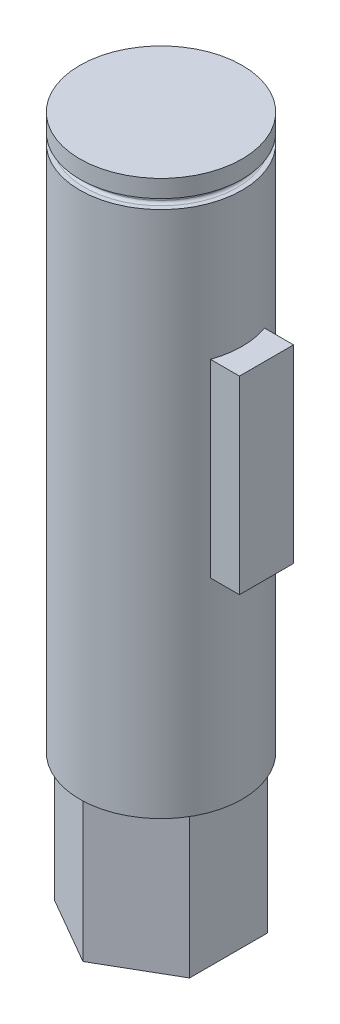
from build123d import *

# Parameters (mm, degrees)
BOSS_EXTRUDE1_DEPTH   = 14
SKETCH2_R             = 6
BOSS_EXTRUDE2_DEPTH   = 12
BOSS_EXTRUDE3_START   = 15
SKETCH3_R             = 6
BOSS_EXTRUDE3_DEPTH   = 15
BOSS_EXTRUDE4_DEPTH   = 10.5
M4_TAPPED_HOLE1_D     = 3.3
M4_TAPPED_HOLE1_DEPTH = 10.1
M4_TAPPED_HOLE1_TIP   = 0.991420021


with BuildPart() as part:
    # Sketch1 → Boss-Extrude1 (new body)
    with BuildSketch(Plane(origin=(0, 0, 0), x_dir=(1, 0, 0), z_dir=(0, 1, 0))):
        with BuildLine():
            Line((7.8, -2), (7.8, 2))
            Line((7.8, 2), (5.656854249, 2))
            ThreePointArc((5.656854249, 2), (-6, 0), (5.656854249, -2))
            Line((5.656854249, -2), (7.8, -2))
        make_face()
    extrude(amount=BOSS_EXTRUDE1_DEPTH)

    # Sketch2 → Boss-Extrude2 (add)
    with BuildSketch(Plane(origin=(0, 14, 0), x_dir=(1, 0, 0), z_dir=(0, 1, 0))):
        with Locations(Location((0, 0, 0), (0, 0, 19.471220634))):
            Circle(SKETCH2_R)
    extrude(amount=BOSS_EXTRUDE2_DEPTH)

    # Sketch3 → Boss-Extrude3 (add)
    with BuildSketch(Plane.XZ.offset(BOSS_EXTRUDE3_START)):
        with Locations(Location((0, 0, 0), (0, 0, 270))):
            Circle(SKETCH3_R)
    extrude(amount=-BOSS_EXTRUDE3_DEPTH)

    # Groove Sketch → Retaining Ring Groove (revolve, cut)
    with BuildSketch(Plane(origin=(1.604252923, 12.182890291, 0.373259529), x_dir=(-0.9343262431877186, 0.2824476966643587, -0.2173885230174828), z_dir=(-0.2266157025474993, 0, 0.9739842521103221)), mode=Mode.PRIVATE) as retaining_ring_groove_sk:
        with BuildLine():
            Line((10.535414006, -9.946396708), (11.998320123, -9.51566397))
            Line((11.998320123, -9.51566397), (11.800606735, -8.84416608))
            Line((11.800606735, -8.84416608), (10.337700618, -9.274898818))
            ThreePointArc((10.337700618, -9.274898818), (10.21858296, -9.371036434), (10.202333617, -9.523244897))
            Line((10.202333617, -9.523244897), (10.287067926, -9.811029707))
            ThreePointArc((10.287067926, -9.811029707), (10.383205542, -9.930147365), (10.535414006, -9.946396708))
        make_face()
    revolve(retaining_ring_groove_sk.sketch.rotate(Axis((0, 60.224615576, 0), (0, -1, 0)), 76.902094509), axis=Axis((0, 60.224615576, 0), (0, -1, 0)), mode=Mode.SUBTRACT)

    # Sketch5 → Boss-Extrude4 (add)
    with BuildSketch(Plane.XZ.offset(15)):
        Polygon((0, 5.773502692), (-5, 2.886751346), (-5, -2.886751346), (0, -5.773502692), (5, -2.886751346), (5, 2.886751346), align=None)
    extrude(amount=BOSS_EXTRUDE4_DEPTH)

    # M4 Tapped Hole1
    with Locations(Plane(origin=(0, -25.5, 0), x_dir=(-1, 0, 0), z_dir=(0, -1, 0))):
        with Locations((0, 0)):
            Hole(M4_TAPPED_HOLE1_D / 2, depth=M4_TAPPED_HOLE1_DEPTH)
            with Locations((0, 0, -(M4_TAPPED_HOLE1_DEPTH + M4_TAPPED_HOLE1_TIP / 2))):  # 118° drill point
                Cone(0, M4_TAPPED_HOLE1_D / 2, M4_TAPPED_HOLE1_TIP, mode=Mode.SUBTRACT)


solid = part.part
